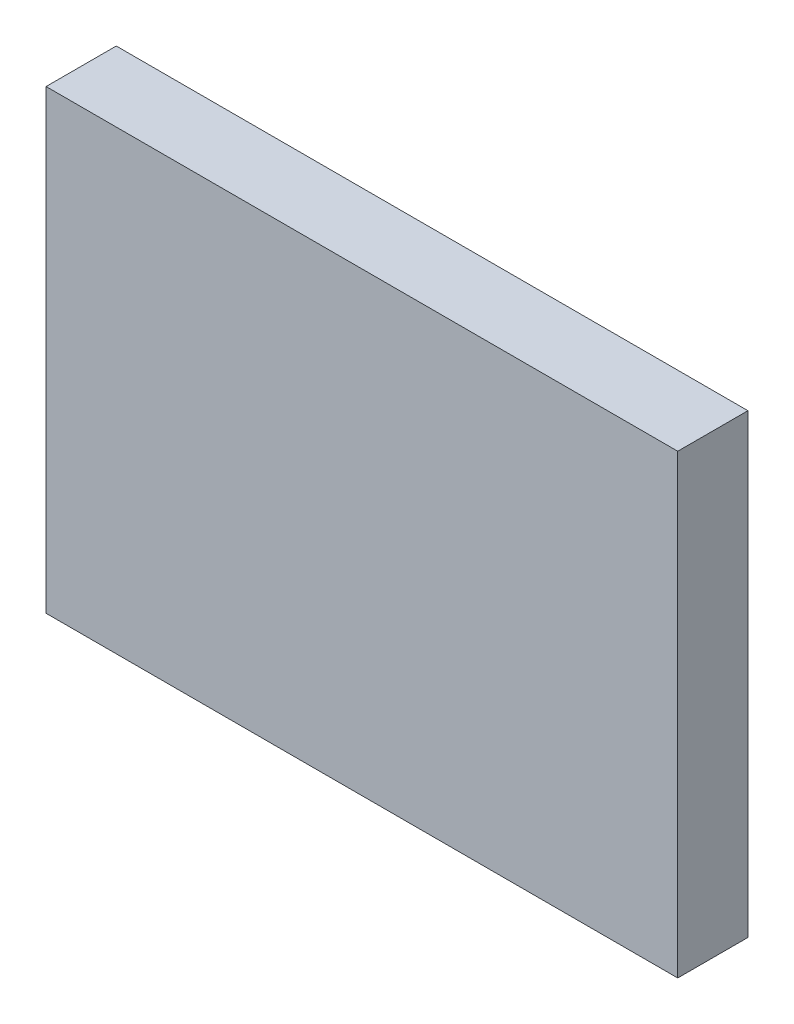
from build123d import *

# Parameters (mm, degrees)
SKETCH1_W                                  = 18
SKETCH1_H                                  = 13
REFERENCE_ENVELOPE_NOT_MANUFACTURING_DEPTH = 2


with BuildPart() as part:
    # Sketch1 → REFERENCE_ENVELOPE_NOT_MANUFACTURING (new body)
    with BuildSketch(Plane.XY):
        Rectangle(SKETCH1_W, SKETCH1_H)
    extrude(amount=REFERENCE_ENVELOPE_NOT_MANUFACTURING_DEPTH)


solid = part.part
